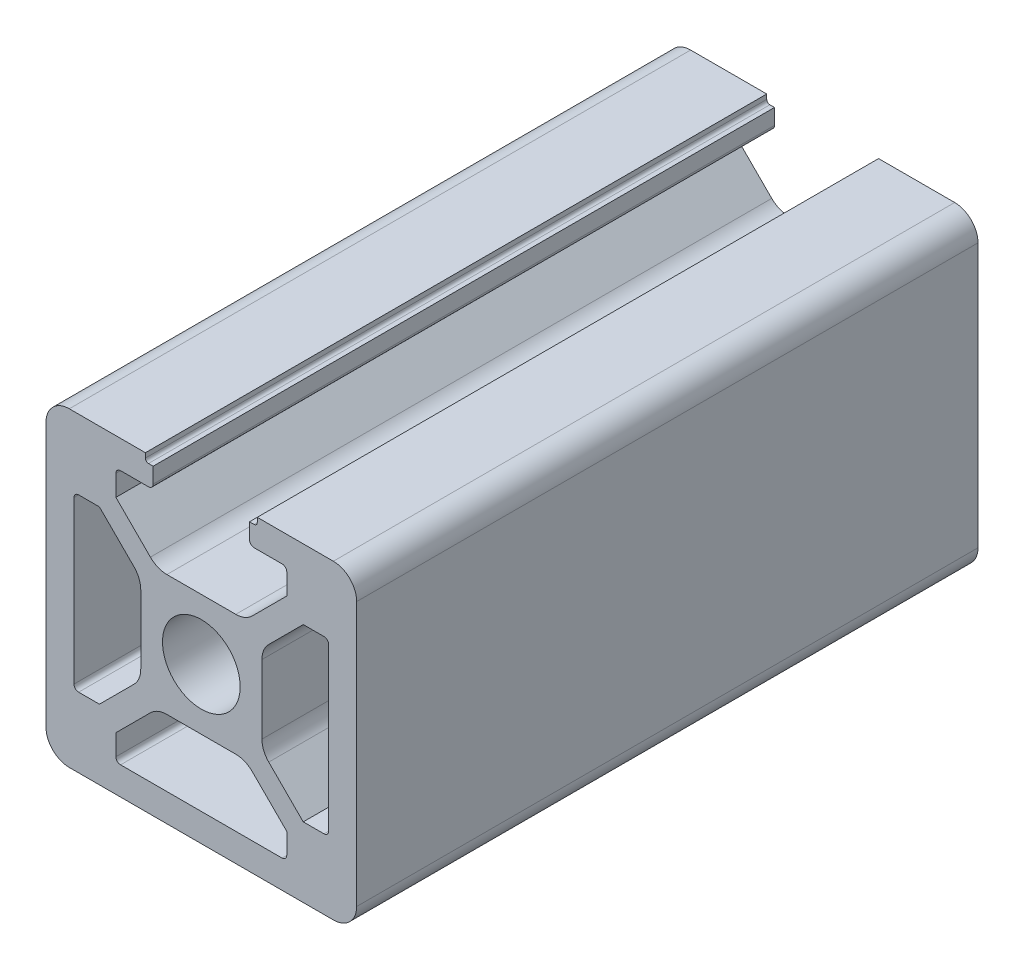
from build123d import *

# Parameters (mm, degrees)
SKETCH_1_R      = 2.5
EXTRUDE_1_DEPTH = 40


with BuildPart() as part:
    # 草图1 → 凸台-拉伸1 (new body)
    with BuildSketch(Plane.XY):
        with BuildLine():
            Line((1604.394788332, 627.726005938), (1604.394788332, 644.726005938))
            ThreePointArc((1604.394788332, 644.726005938), (1603.955448504, 645.78666611), (1602.894788332, 646.226005938))
            Line((1602.894788332, 646.226005938), (1597.994788332, 646.226005938))
            Line((1597.994788332, 646.226005938), (1597.994788332, 645.926005938))
            ThreePointArc((1597.994788332, 645.926005938), (1597.936209689, 645.784584582), (1597.794788332, 645.726005938))
            Line((1597.794788332, 645.726005938), (1597.494788332, 645.726005938))
            Line((1597.494788332, 645.726005938), (1597.494788332, 644.726005938))
            ThreePointArc((1597.494788332, 644.726005938), (1597.582656298, 644.513873904), (1597.794788332, 644.426005938))
            Line((1597.794788332, 644.426005938), (1599.594788332, 644.426005938))
            ThreePointArc((1599.594788332, 644.426005938), (1599.806920367, 644.338137973), (1599.894788332, 644.126005938))
            Line((1599.894788332, 644.126005938), (1599.894788332, 642.786005938))
            Line((1599.894788332, 642.786005938), (1597.674128161, 640.565345767))
            ThreePointArc((1597.674128161, 640.565345767), (1597.187493137, 640.24018664), (1596.613467989, 640.126005938))
            Line((1596.613467989, 640.126005938), (1592.176108676, 640.126005938))
            ThreePointArc((1592.176108676, 640.126005938), (1591.602083527, 640.24018664), (1591.115448504, 640.565345767))
            Line((1591.115448504, 640.565345767), (1588.894788332, 642.786005938))
            Line((1588.894788332, 642.786005938), (1588.894788332, 644.126005938))
            ThreePointArc((1588.894788332, 644.126005938), (1588.982656298, 644.338137973), (1589.194788332, 644.426005938))
            Line((1589.194788332, 644.426005938), (1590.994788332, 644.426005938))
            ThreePointArc((1590.994788332, 644.426005938), (1591.206920367, 644.513873904), (1591.294788332, 644.726005938))
            Line((1591.294788332, 644.726005938), (1591.294788332, 645.726005938))
            Line((1591.294788332, 645.726005938), (1590.994788332, 645.726005938))
            ThreePointArc((1590.994788332, 645.726005938), (1590.853366976, 645.784584582), (1590.794788332, 645.926005938))
            Line((1590.794788332, 645.926005938), (1590.794788332, 646.226005938))
            Line((1590.794788332, 646.226005938), (1585.894788332, 646.226005938))
            ThreePointArc((1585.894788332, 646.226005938), (1584.834128161, 645.78666611), (1584.394788332, 644.726005938))
            Line((1584.394788332, 644.726005938), (1584.394788332, 627.726005938))
            ThreePointArc((1584.394788332, 627.726005938), (1584.834128161, 626.665345767), (1585.894788332, 626.226005938))
            Line((1585.894788332, 626.226005938), (1602.894788332, 626.226005938))
            ThreePointArc((1602.894788332, 626.226005938), (1603.955448504, 626.665345767), (1604.394788332, 627.726005938))
        make_face()
        with Locations((1594.394788332, 636.226005938)):
            Circle(SKETCH_1_R, mode=Mode.SUBTRACT)
        with BuildLine():
            Line((1598.734128161, 639.505345767), (1600.954788332, 641.726005938))
            Line((1600.954788332, 641.726005938), (1602.294788332, 641.726005938))
            ThreePointArc((1602.294788332, 641.726005938), (1602.506920367, 641.638137973), (1602.594788332, 641.426005938))
            Line((1602.594788332, 641.426005938), (1602.594788332, 631.026005938))
            ThreePointArc((1602.594788332, 631.026005938), (1602.506920367, 630.813873904), (1602.294788332, 630.726005938))
            Line((1602.294788332, 630.726005938), (1600.954788332, 630.726005938))
            Line((1600.954788332, 630.726005938), (1598.734128161, 632.94666611))
            ThreePointArc((1598.734128161, 632.94666611), (1598.408969034, 633.433301133), (1598.294788332, 634.007326282))
            Line((1598.294788332, 634.007326282), (1598.294788332, 638.444685595))
            ThreePointArc((1598.294788332, 638.444685595), (1598.408969034, 639.018710743), (1598.734128161, 639.505345767))
        make_face(mode=Mode.SUBTRACT)
        with BuildLine():
            Line((1586.194788332, 631.026005938), (1586.194788332, 641.426005938))
            ThreePointArc((1586.194788332, 641.426005938), (1586.282656298, 641.638137973), (1586.494788332, 641.726005938))
            Line((1586.494788332, 641.726005938), (1587.834788332, 641.726005938))
            Line((1587.834788332, 641.726005938), (1590.055448504, 639.505345767))
            ThreePointArc((1590.055448504, 639.505345767), (1590.380607631, 639.018710743), (1590.494788332, 638.444685595))
            Line((1590.494788332, 638.444685595), (1590.494788332, 634.007326282))
            ThreePointArc((1590.494788332, 634.007326282), (1590.380607631, 633.433301133), (1590.055448504, 632.94666611))
            Line((1590.055448504, 632.94666611), (1587.834788332, 630.726005938))
            Line((1587.834788332, 630.726005938), (1586.494788332, 630.726005938))
            ThreePointArc((1586.494788332, 630.726005938), (1586.282656298, 630.813873904), (1586.194788332, 631.026005938))
        make_face(mode=Mode.SUBTRACT)
        with BuildLine():
            Line((1599.594788332, 628.026005938), (1589.194788332, 628.026005938))
            ThreePointArc((1589.194788332, 628.026005938), (1588.982656298, 628.113873904), (1588.894788332, 628.326005938))
            Line((1588.894788332, 628.326005938), (1588.894788332, 629.666005938))
            Line((1588.894788332, 629.666005938), (1591.115448504, 631.88666611))
            ThreePointArc((1591.115448504, 631.88666611), (1591.602083527, 632.211825237), (1592.176108676, 632.326005938))
            Line((1592.176108676, 632.326005938), (1596.613467989, 632.326005938))
            ThreePointArc((1596.613467989, 632.326005938), (1597.187493137, 632.211825237), (1597.674128161, 631.88666611))
            Line((1597.674128161, 631.88666611), (1599.894788332, 629.666005938))
            Line((1599.894788332, 629.666005938), (1599.894788332, 628.326005938))
            ThreePointArc((1599.894788332, 628.326005938), (1599.806920367, 628.113873904), (1599.594788332, 628.026005938))
        make_face(mode=Mode.SUBTRACT)
    extrude(amount=EXTRUDE_1_DEPTH)


solid = part.part
